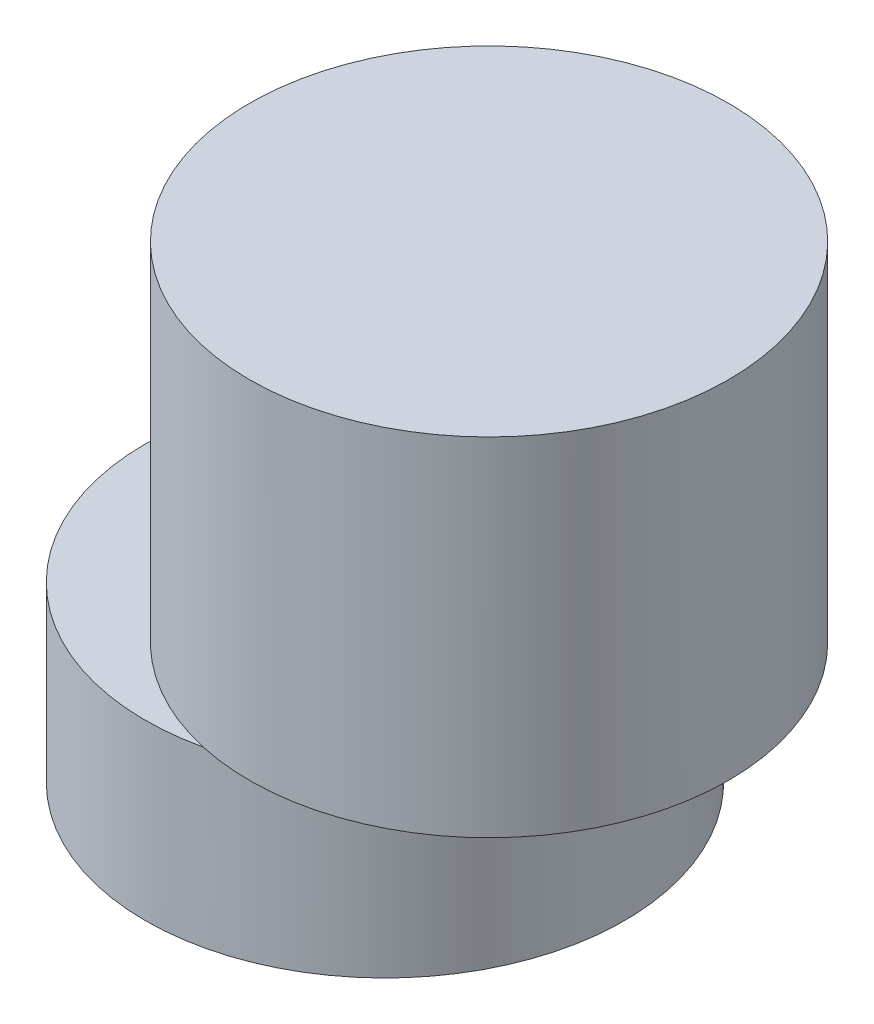
from build123d import *

# Parameters (mm, degrees)
SKETCH1_R           = 3.45
BOSS_EXTRUDE1_DEPTH = 2.5
SKETCH2_R           = 3.45
BOSS_EXTRUDE2_DEPTH = 5


with BuildPart() as part:
    # Sketch1 → Boss-Extrude1 (new body)
    with BuildSketch(Plane(origin=(0, 0, 0), x_dir=(1, 0, 0), z_dir=(0, 1, 0))):
        with Locations(Location((0, 0, 0), (0, 0, 270))):
            Circle(SKETCH1_R)
    extrude(amount=BOSS_EXTRUDE1_DEPTH)

    # Sketch2 → Boss-Extrude2 (add)
    with BuildSketch(Plane(origin=(0, 2.5, 0), x_dir=(1, 0, 0), z_dir=(0, 1, 0))):
        with Locations(Location((1.5, 0, 0), (0, 0, 102.555857799))):
            Circle(SKETCH2_R)
    extrude(amount=BOSS_EXTRUDE2_DEPTH)


solid = part.part
